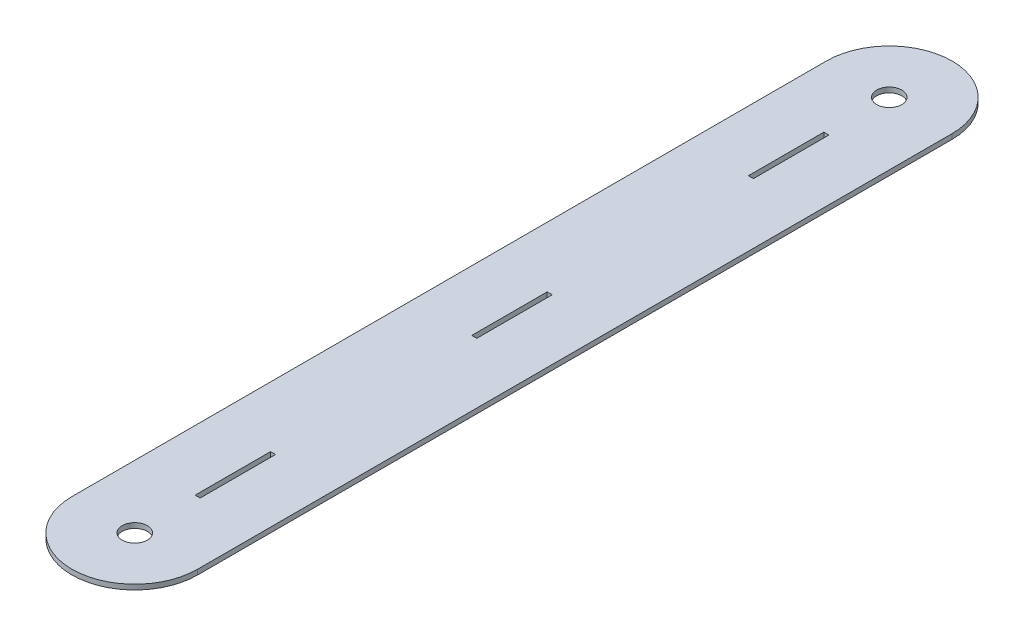
from build123d import *

# Parameters (mm, degrees)
SKETCH1_R           = 2.5
SKETCH1_W           = 1
SKETCH1_H           = 15
BOSS_EXTRUDE1_DEPTH = 1


with BuildPart() as part:
    # Sketch1 → Boss-Extrude1 (new body)
    with BuildSketch(Plane(origin=(0, 0, 0), x_dir=(1, 0, 0), z_dir=(0, 1, 0))):
        with BuildLine():
            Line((12.5, 150), (12.5, 0))
            ThreePointArc((12.5, 0), (0, -12.5), (-12.5, 0))
            Line((-12.5, 0), (-12.5, 150))
            ThreePointArc((-12.5, 150), (0, 162.5), (12.5, 150))
        make_face()
        with Locations(Location((0, 0, 0), (0, 0, 270))):
            Circle(SKETCH1_R, mode=Mode.SUBTRACT)
        with Locations(Location((0, 150, 0), (0, 0, 270))):
            Circle(SKETCH1_R, mode=Mode.SUBTRACT)
        with Locations((0, 75)):
            Rectangle(SKETCH1_W, SKETCH1_H, mode=Mode.SUBTRACT)
        with Locations((0, 20)):
            Rectangle(SKETCH1_W, SKETCH1_H, mode=Mode.SUBTRACT)
        with Locations((0, 130)):
            Rectangle(SKETCH1_W, SKETCH1_H, mode=Mode.SUBTRACT)
    extrude(amount=BOSS_EXTRUDE1_DEPTH)


solid = part.part
